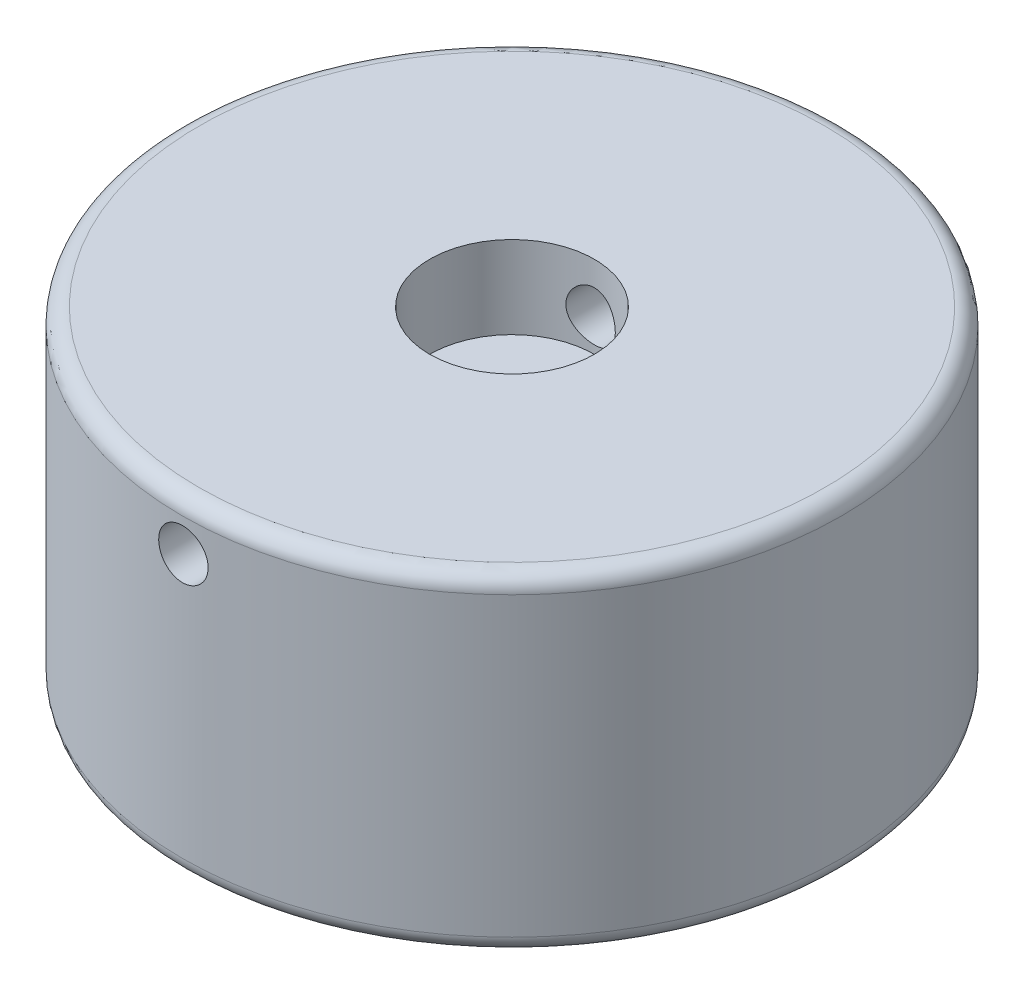
from build123d import *

# Parameters (mm, degrees)
SKETCH1_R           = 20
BOSS_EXTRUDE1_DEPTH = 20
SKETCH2_R           = 5
CUT_EXTRUDE1_DEPTH  = 5
SKETCH3_R           = 1.5
CUT_EXTRUDE2_DEPTH  = 49.989794856
FILLET1_R           = 1
FILLET2_R           = 1


with BuildPart() as part:
    # Sketch1 → Boss-Extrude1 (new body)
    with BuildSketch(Plane(origin=(0, 0, 0), x_dir=(1, 0, 0), z_dir=(0, 1, 0))):
        with Locations(Location((0, 0, 0), (0, 0, 270))):
            Circle(SKETCH1_R)
    extrude(amount=BOSS_EXTRUDE1_DEPTH)

    # Sketch2 → Cut-Extrude1 (cut)
    with BuildSketch(Plane(origin=(0, 20, 0), x_dir=(1, 0, 0), z_dir=(0, 1, 0))):
        with Locations(Location((0, 0, 0), (0, 0, 270))):
            Circle(SKETCH2_R)
    extrude(amount=-CUT_EXTRUDE1_DEPTH, mode=Mode.SUBTRACT)

    # Sketch3 → Cut-Extrude2 (cut, through all)
    with BuildSketch(Plane.XY.offset(20)):
        with Locations((0, 17)):
            Circle(SKETCH3_R)
    extrude(amount=-CUT_EXTRUDE2_DEPTH, mode=Mode.SUBTRACT)

    # Fillet1
    fillet1_edges = [part.edges().sort_by_distance(p)[0] for p in [
        (0, 0, -20),
    ]]
    fillet(fillet1_edges, radius=FILLET1_R)

    # Fillet2
    fillet2_edges = [part.edges().sort_by_distance(p)[0] for p in [
        (0, 20, -20),
    ]]
    fillet(fillet2_edges, radius=FILLET2_R)


solid = part.part
